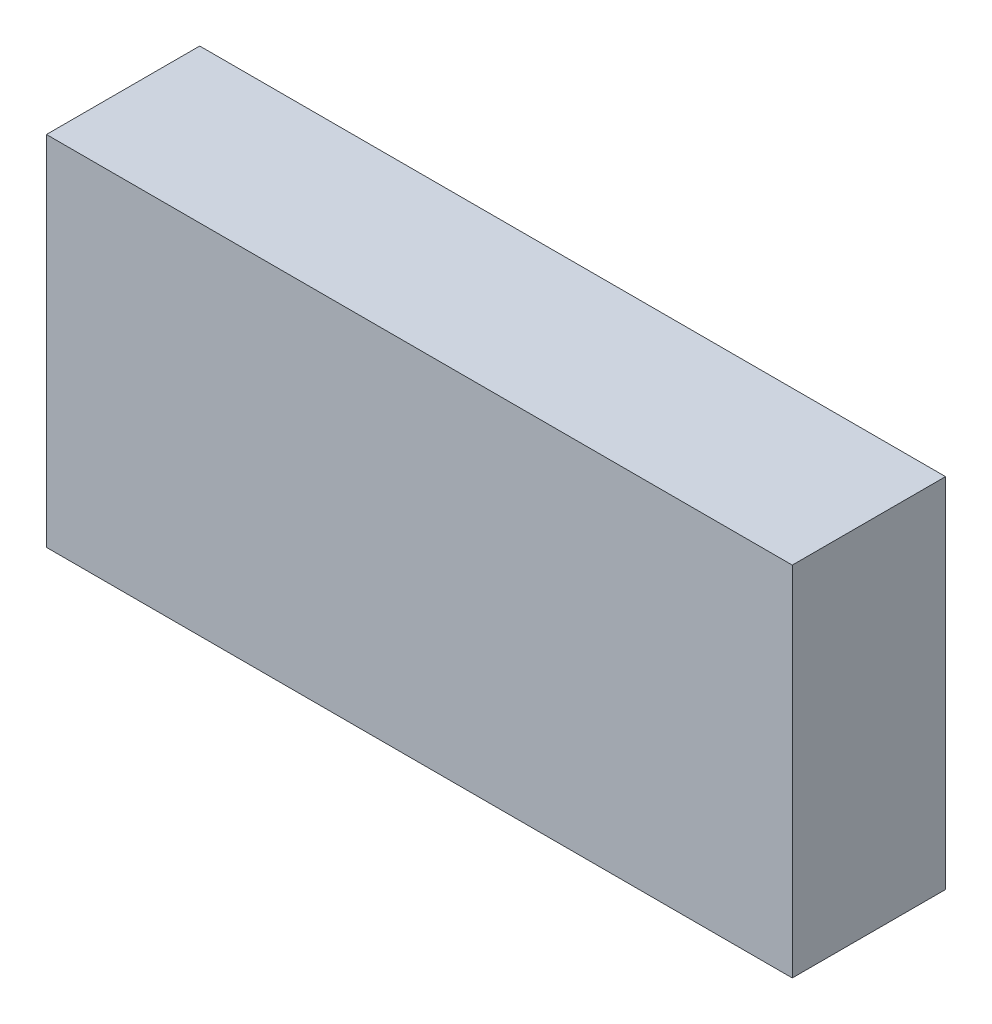
from build123d import *

# Parameters (mm, degrees)
ESBO_O1_W                = 73
ESBO_O1_H                = 35
RESSALTO_EXTRUS_O1_DEPTH = 15


with BuildPart() as part:
    # Esboço1 → Ressalto-extrusão1 (new body)
    with BuildSketch(Plane.XY):
        Rectangle(ESBO_O1_W, ESBO_O1_H)
    extrude(amount=RESSALTO_EXTRUS_O1_DEPTH)


solid = part.part
